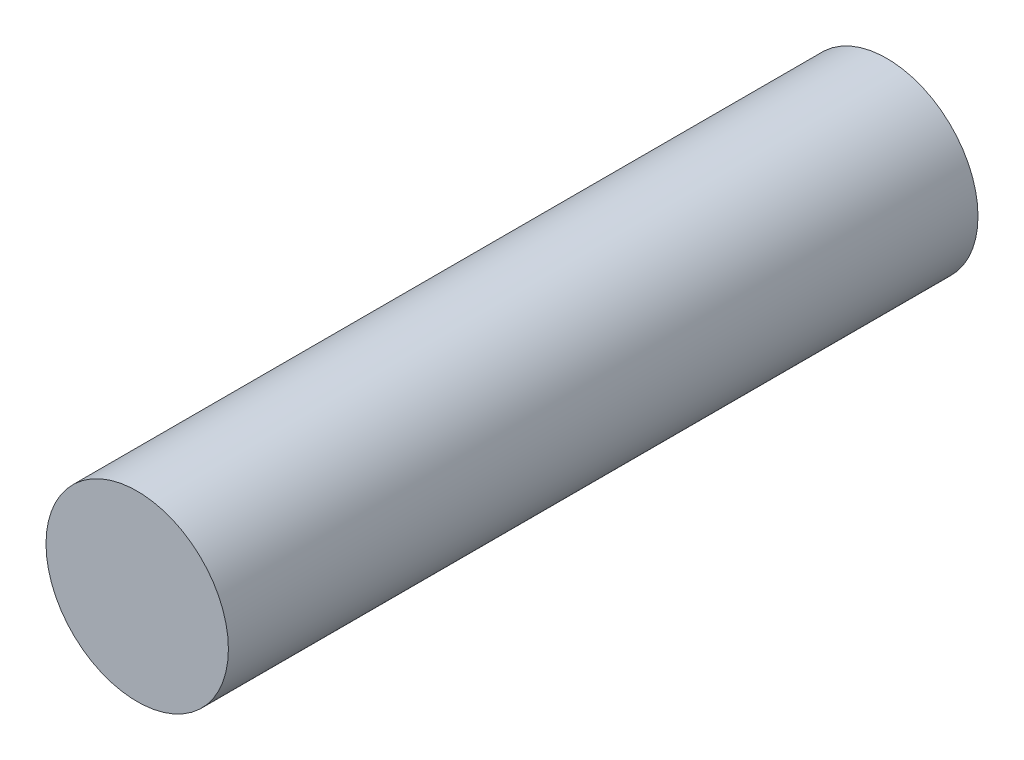
from build123d import *

# Parameters (mm, degrees)
SCHIZZO1_R                   = 73
ESTRUSIONE_ESTRUSIONE1_DEPTH = 600


with BuildPart() as part:
    # Schizzo1 → Estrusione-Estrusione1 (new body)
    with BuildSketch(Plane.XY):
        Circle(SCHIZZO1_R)
    extrude(amount=ESTRUSIONE_ESTRUSIONE1_DEPTH)


solid = part.part
